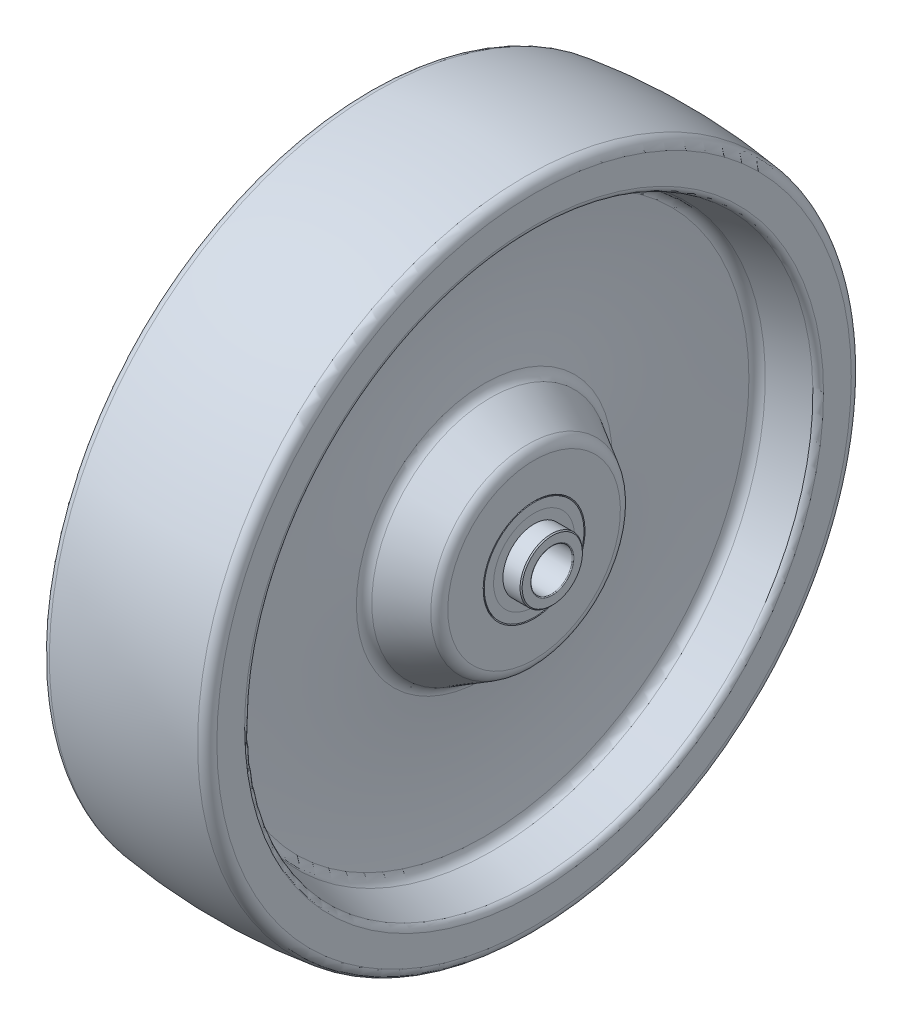
from build123d import *

# Parameters (mm, degrees)
SKETCH4_W               = 50.8
SKETCH4_H               = 2.8575
SKETCH7_W               = 50.8
SKETCH7_H               = 2.8575
CUT_EXTRUDE1_DEPTH      = 147.98098331
CUT_EXTRUDE1_DEPTH_BACK = 147.98098331
SKETCH9_R               = 2.43205
FILLET1_R               = 3.175


with BuildPart() as part:
    # Sketch3 → Revolve1 (revolve)
    with BuildSketch(Plane.XY, mode=Mode.PRIVATE) as revolve1_sk:
        with BuildLine():
            Line((-25.4, 99.695), (-25.4, 88.456757912))
            ThreePointArc((-25.4, 88.456757912), (-25.006338113, 87.29706739), (-23.988050281, 86.616669213))
            Line((-23.988050281, 86.616669213), (-12.513249532, 83.542005619))
            ThreePointArc((-12.513249532, 83.542005619), (-10.940619493, 82.560273131), (-10.184347508, 80.867637139))
            ThreePointArc((-10.184347508, 80.867637139), (-8.89, 59.984506606), (-10.189329467, 39.101685455))
            ThreePointArc((-10.189329467, 39.101685455), (-10.794986314, 37.467486519), (-12.065, 36.27396584))
            Line((-12.065, 36.27396584), (-23.495, 29.674852263))
            ThreePointArc((-23.495, 29.674852263), (-24.889556788, 28.280295474), (-25.4, 26.375295474))
            Line((-25.4, 26.375295474), (-25.4, 15.5575))
            Line((-25.4, 15.5575), (-25.0825, 15.24))
            Line((-25.0825, 15.24), (25.0825, 15.24))
            Line((25.0825, 15.24), (25.4, 15.5575))
            Line((25.4, 15.5575), (25.4, 26.375295474))
            ThreePointArc((25.4, 26.375295474), (24.889556788, 28.280295474), (23.495, 29.674852263))
            Line((23.495, 29.674852263), (12.065, 36.27396584))
            ThreePointArc((12.065, 36.27396584), (10.794986314, 37.467486519), (10.189329467, 39.101685455))
            ThreePointArc((10.189329467, 39.101685455), (8.89, 59.984506606), (10.184347508, 80.867637139))
            ThreePointArc((10.184347508, 80.867637139), (10.940619493, 82.560273131), (12.513249532, 83.542005619))
            Line((12.513249532, 83.542005619), (23.988050281, 86.616669213))
            ThreePointArc((23.988050281, 86.616669213), (25.006338113, 87.29706739), (25.4, 88.456757912))
            Line((25.4, 88.456757912), (25.4, 99.695))
            ThreePointArc((25.4, 99.695), (0, 101.6), (-25.4, 99.695))
        make_face()
    revolve(revolve1_sk.sketch.rotate(Axis((-30.95625, 0, 0), (1, 0, 0)), 180), axis=Axis((-30.95625, 0, 0), (1, 0, 0)))

    # Fillet1
    fillet1_edges = [part.edges().sort_by_distance(p)[0] for p in [
        (25.4, 99.695, 0),
        (-25.4, 99.695, 0),
    ]]
    fillet(fillet1_edges, radius=FILLET1_R)


with BuildPart() as body_2:
    # Sketch4 → Revolve2 (revolve)
    with BuildSketch(Plane.XY, mode=Mode.PRIVATE) as revolve2_sk:
        with Locations((0, 13.81125)):
            Rectangle(SKETCH4_W, SKETCH4_H)
    revolve(revolve2_sk.sketch.rotate(Axis((-30.95625, 0, 0), (1, 0, 0)), 180), axis=Axis((-30.95625, 0, 0), (1, 0, 0)))


with BuildPart() as body_3:
    # Sketch7 → Revolve3 (revolve)
    with BuildSketch(Plane.XY, mode=Mode.PRIVATE) as revolve3_sk:
        with Locations((0, 10.95375)):
            Rectangle(SKETCH7_W, SKETCH7_H)
    revolve(revolve3_sk.sketch.rotate(Axis((-30.95625, 0, 0), (1, 0, 0)), 180), axis=Axis((-30.95625, 0, 0), (1, 0, 0)))


with BuildPart() as body_4:
    # Sketch8 → Revolve4 (revolve)
    with BuildSketch(Plane.XY, mode=Mode.PRIVATE) as revolve4_sk:
        with BuildLine():
            Line((30.95625, 6.604), (30.95625, 9.2075))
            Line((30.95625, 9.2075), (30.63875, 9.525))
            Line((30.63875, 9.525), (-30.63875, 9.525))
            Line((-30.63875, 9.525), (-30.95625, 9.2075))
            Line((-30.95625, 9.2075), (-30.95625, 6.604))
            ThreePointArc((-30.95625, 6.604), (-30.881855122, 6.424394878), (-30.70225, 6.35))
            Line((-30.70225, 6.35), (30.70225, 6.35))
            ThreePointArc((30.70225, 6.35), (30.881855122, 6.424394878), (30.95625, 6.604))
        make_face()
    revolve(revolve4_sk.sketch.rotate(Axis((-30.95625, 0, 0), (1, 0, 0)), 180), axis=Axis((-30.95625, 0, 0), (1, 0, 0)))

    # Sketch9 → Cut-Extrude1 (cut, two sides: drawn at the far end of the back side and taken through both)
    with BuildSketch(Plane.XY.offset(-CUT_EXTRUDE1_DEPTH_BACK)):
        Circle(SKETCH9_R)
    extrude(amount=CUT_EXTRUDE1_DEPTH + CUT_EXTRUDE1_DEPTH_BACK, mode=Mode.SUBTRACT)


solid = Compound([part.part, body_2.part, body_3.part, body_4.part])
